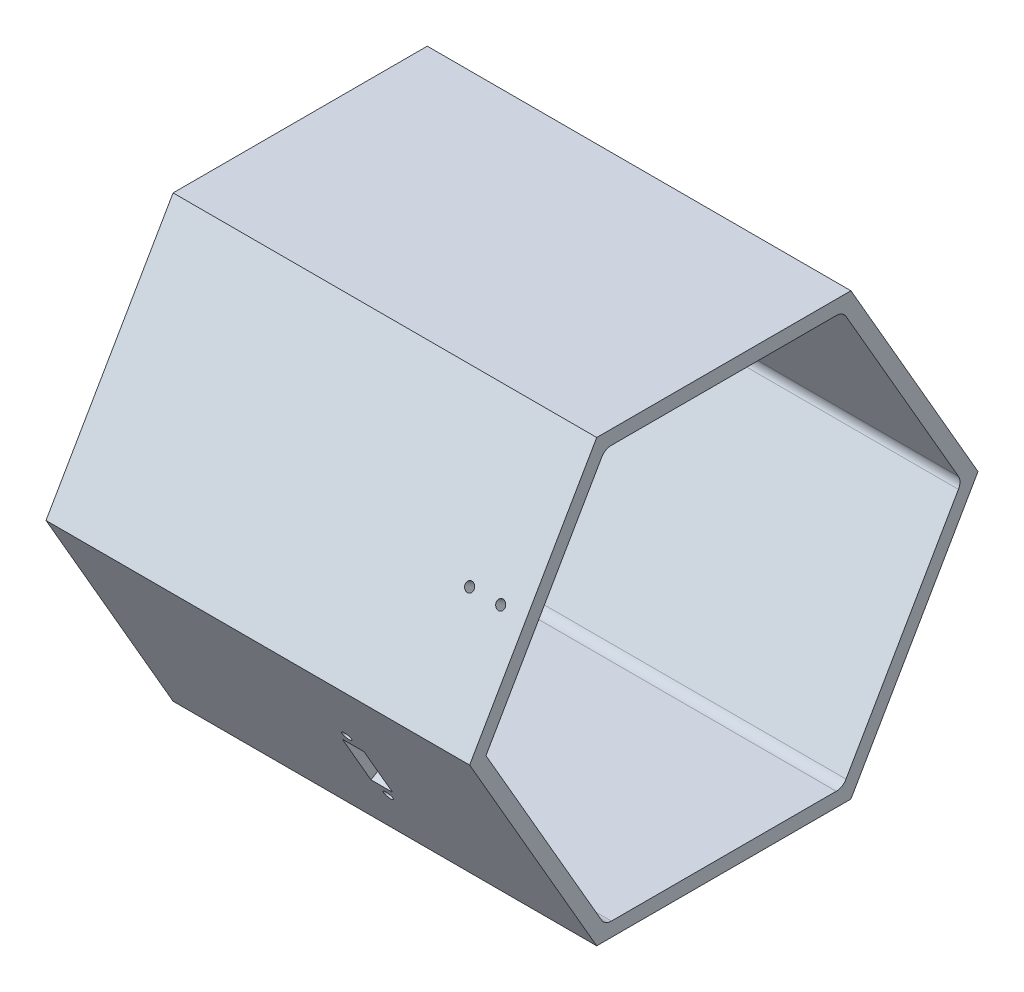
from build123d import *

# Parameters (mm, degrees)
BOSS_EXTRUDE1_DEPTH = 200
CUT_EXTRUDE1_DEPTH  = 195
SKETCH5_R           = 1.65
SKETCH5_W           = 7.65
SKETCH5_H           = 20.2
CUT_EXTRUDE4_DEPTH  = 70
SKETCH7_R           = 4.5
SKETCH7_R_2         = 3
CUT_EXTRUDE6_DEPTH  = 70
FILLET1_R           = 4
CUT_EXTRUDE7_DEPTH  = 70
SKETCH10_R          = 1.6
CUT_EXTRUDE8_DEPTH  = 6
BOSS_EXTRUDE2_DEPTH = 20


with BuildPart() as part:
    # Sketch1 → Boss-Extrude1 (new body)
    with BuildSketch(Plane(origin=(0, 0, 0), x_dir=(0, 0, -1), z_dir=(1, 0, 0))):
        Polygon((90, 0), (45, 77.942286341), (-45, 77.942286341), (-90, 0), (-45, -77.942286341), (45, -77.942286341), align=None)
    extrude(amount=BOSS_EXTRUDE1_DEPTH)

    # Sketch2 → Cut-Extrude1 (cut)
    with BuildSketch(Plane(origin=(200, 0, 0), x_dir=(0, 0, -1), z_dir=(1, 0, 0))):
        Polygon((84.226497308, 0), (42.113248654, 72.942286341), (-42.113248654, 72.942286341), (-84.226497308, 0), (-42.113248654, -72.942286341), (42.113248654, -72.942286341), align=None)
    extrude(amount=-CUT_EXTRUDE1_DEPTH, mode=Mode.SUBTRACT)

    # Sketch5 → Cut-Extrude4 (cut)
    with BuildSketch(Plane(origin=(0, -38.97114317, 67.5), x_dir=(1, 0, 0), z_dir=(0, -0.500000000000007, 0.8660254037844347))):
        with Locations(Location((68.825, 9.75, 0), (0, 0, 270))):
            Circle(SKETCH5_R)
        with Locations(Location((68.825, -19.75, 0), (0, 0, 270))):
            Circle(SKETCH5_R)
        with Locations((68.825, -5)):
            Rectangle(SKETCH5_W, SKETCH5_H)
    extrude(amount=-CUT_EXTRUDE4_DEPTH, mode=Mode.SUBTRACT)

    # Sketch7 → Cut-Extrude6 (cut)
    with BuildSketch(Plane(origin=(5, 0, 0), x_dir=(0, 0, -1), z_dir=(1, 0, 0))):
        Circle(SKETCH7_R)
        with Locations((60, 0)):
            Circle(SKETCH7_R_2)
        with Locations((30, 51.961524227)):
            Circle(SKETCH7_R_2)
        with Locations((-30, 51.961524227)):
            Circle(SKETCH7_R_2)
        with Locations((-60, 0)):
            Circle(SKETCH7_R_2)
        with Locations((-30, -51.961524227)):
            Circle(SKETCH7_R_2)
        with Locations((30, -51.961524227)):
            Circle(SKETCH7_R_2)
    extrude(amount=-CUT_EXTRUDE6_DEPTH, mode=Mode.SUBTRACT)

    # Fillet1
    fillet1_edges = [part.edges().sort_by_distance(p)[0] for p in [
        (5, -36.47114317, -63.169872981),
        (102.5, 0, -84.226497308),
        (5, -72.942286341, 0),
        (102.5, -72.942286341, -42.113248654),
        (5, -36.47114317, 63.169872981),
        (102.5, -72.942286341, 42.113248654),
        (5, 36.47114317, 63.169872981),
        (5, 72.942286341, 0),
        (102.5, 72.942286341, 42.113248654),
        (5, 36.47114317, -63.169872981),
        (102.5, 72.942286341, -42.113248654),
    ]]
    fillet(fillet1_edges, radius=FILLET1_R)

    # Sketch9 → Cut-Extrude7 (cut)
    with BuildSketch(Plane(origin=(200, 0, 0), x_dir=(0, 0, -1), z_dir=(1, 0, 0))):
        Polygon((45, 77.942286341), (90, 0), (45, -77.942286341), (-45, -77.942286341), (-90, 0), (-45, 77.942286341), align=None)
    extrude(amount=-CUT_EXTRUDE7_DEPTH, mode=Mode.SUBTRACT)

    # Sketch10 → Cut-Extrude8 (cut)
    with BuildSketch(Plane(origin=(0, 38.97114317, 67.5), x_dir=(1, 0, 0), z_dir=(0, 0.49999999999999495, 0.8660254037844417))):
        with Locations(Location((110, -5, 0), (0, 0, 270))):
            Circle(SKETCH10_R)
        with Locations(Location((121, -5, 0), (0, 0, 270))):
            Circle(SKETCH10_R)
    extrude(amount=-CUT_EXTRUDE8_DEPTH, mode=Mode.SUBTRACT)

    # Sketch11 → Boss-Extrude2 (add)
    with BuildSketch(Plane.ZY):
        Polygon((90, 0), (45, 77.942286341), (-45, 77.942286341), (-90, 0), (-45, -77.942286341), (45, -77.942286341), align=None)
        Polygon((84.226497308, 0), (42.113248654, 72.942286341), (-42.113248654, 72.942286341), (-84.226497308, 0), (-42.113248654, -72.942286341), (42.113248654, -72.942286341), align=None, mode=Mode.SUBTRACT)
    extrude(amount=BOSS_EXTRUDE2_DEPTH)


solid = part.part
